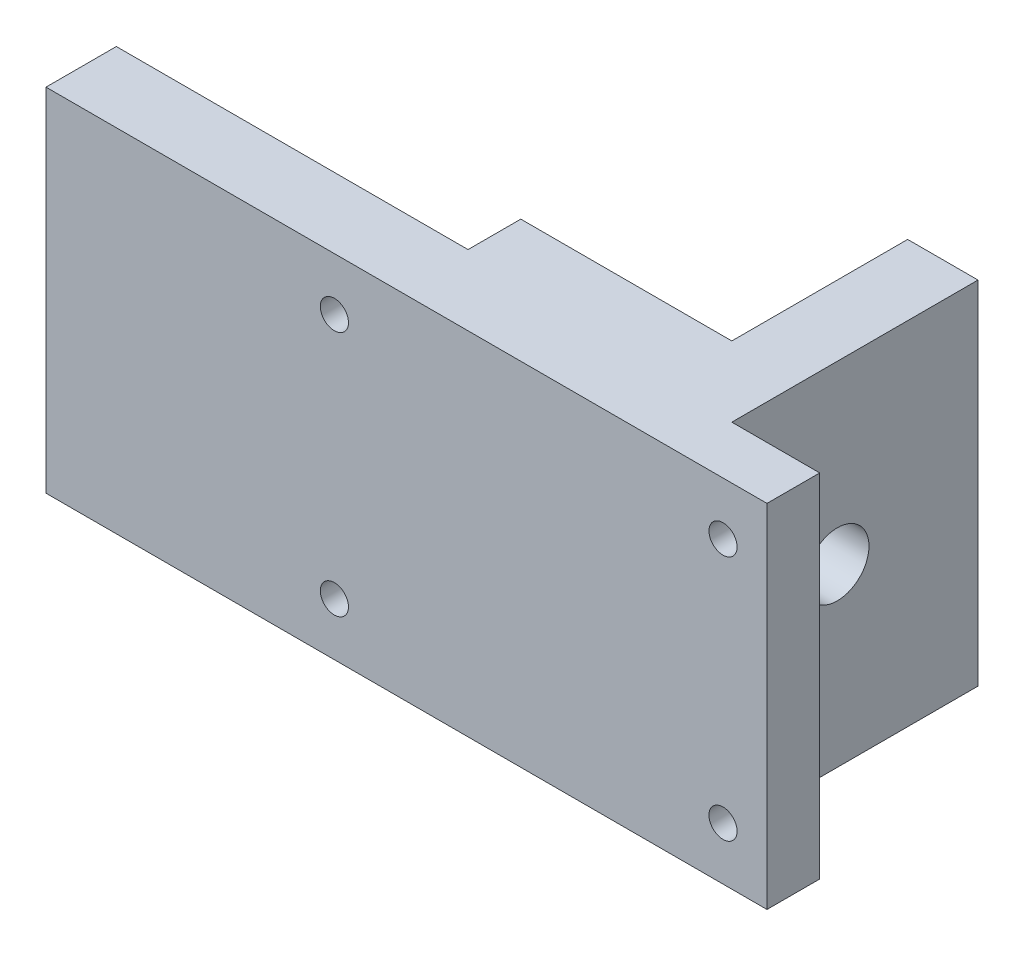
from build123d import *

# Parameters (mm, degrees)
BOSS_EXTRUDE2_DEPTH = 100
SKETCH3_W           = 60
SKETCH3_H           = 29
BOSS_EXTRUDE3_DEPTH = 15
SKETCH4_R           = 4
CUT_EXTRUDE1_DEPTH  = 15
HOLE2_AT_2_COUNT    = 2
HOLE2_AT_2_PITCH    = 70
SKETCH9_R           = 3
CUT_EXTRUDE2_DEPTH  = 15
SKETCH10_R          = 9
CUT_EXTRUDE3_DEPTH  = 52


with BuildPart() as part:
    # Sketch1 → Boss-Extrude2 (new body)
    with BuildSketch(Plane(origin=(0, 0, 0), x_dir=(1, 0, 0), z_dir=(0, 1, 0))):
        Polygon((-160, 0), (45, 0), (45, 15), (20, 15), (20, 85), (0, 85), (0, 20), (-160, 20), align=None)
    extrude(amount=BOSS_EXTRUDE2_DEPTH)

    # Sketch3 → Boss-Extrude3 (add)
    with BuildSketch(Plane(origin=(0, 0, -20), x_dir=(-1, 0, 0), z_dir=(0, 0, -1))):
        with Locations((30, 85.5)):
            Rectangle(SKETCH3_W, SKETCH3_H)
        with Locations((30, 14.5)):
            Rectangle(SKETCH3_W, SKETCH3_H)
    extrude(amount=BOSS_EXTRUDE3_DEPTH)

    # Sketch4 → Cut-Extrude1 (cut)
    with BuildSketch(Plane(origin=(0, 0, -15), x_dir=(-1, 0, 0), z_dir=(0, 0, -1))):
        with Locations((-32.5, 85)):
            Circle(SKETCH4_R)
        with Locations((-32.5, 15)):
            Circle(SKETCH4_R)
    extrude(amount=-CUT_EXTRUDE1_DEPTH, mode=Mode.SUBTRACT)

    # Sketch8 → Hole2 (revolve, cut)
    with BuildSketch(Plane(origin=(-78, 85, -20), x_dir=(0, 1, 0), z_dir=(1, 0, 0))):
        Polygon((0, 0), (0, 20), (4, 20), (4, 7.103012167), (7.5, 5), (7.5, 0), align=None)
    hole2 = revolve(axis=Axis((-78, 85, -26.130023899), (0, 0, 1)), mode=Mode.SUBTRACT)

    # Hole2 at 2: Hole2 ×2
    with Locations(*[(0, -i * HOLE2_AT_2_PITCH, 0) for i in range(1, HOLE2_AT_2_COUNT)]):
        add(hole2, mode=Mode.SUBTRACT)

    # Sketch9 → Cut-Extrude2 (cut)
    with BuildSketch(Plane(origin=(0, 0, -20), x_dir=(-1, 0, 0), z_dir=(0, 0, -1))):
        with Locations((137.5, 67)):
            Circle(SKETCH9_R)
        with Locations((137.5, 33)):
            Circle(SKETCH9_R)
    extrude(amount=-CUT_EXTRUDE2_DEPTH, mode=Mode.SUBTRACT)

    # Sketch10 → Cut-Extrude3 (cut)
    with BuildSketch(Plane(origin=(20, 0, 0), x_dir=(0, 0, -1), z_dir=(1, 0, 0))):
        with Locations((45, 50)):
            Circle(SKETCH10_R)
    extrude(amount=-CUT_EXTRUDE3_DEPTH, mode=Mode.SUBTRACT)


solid = part.part
